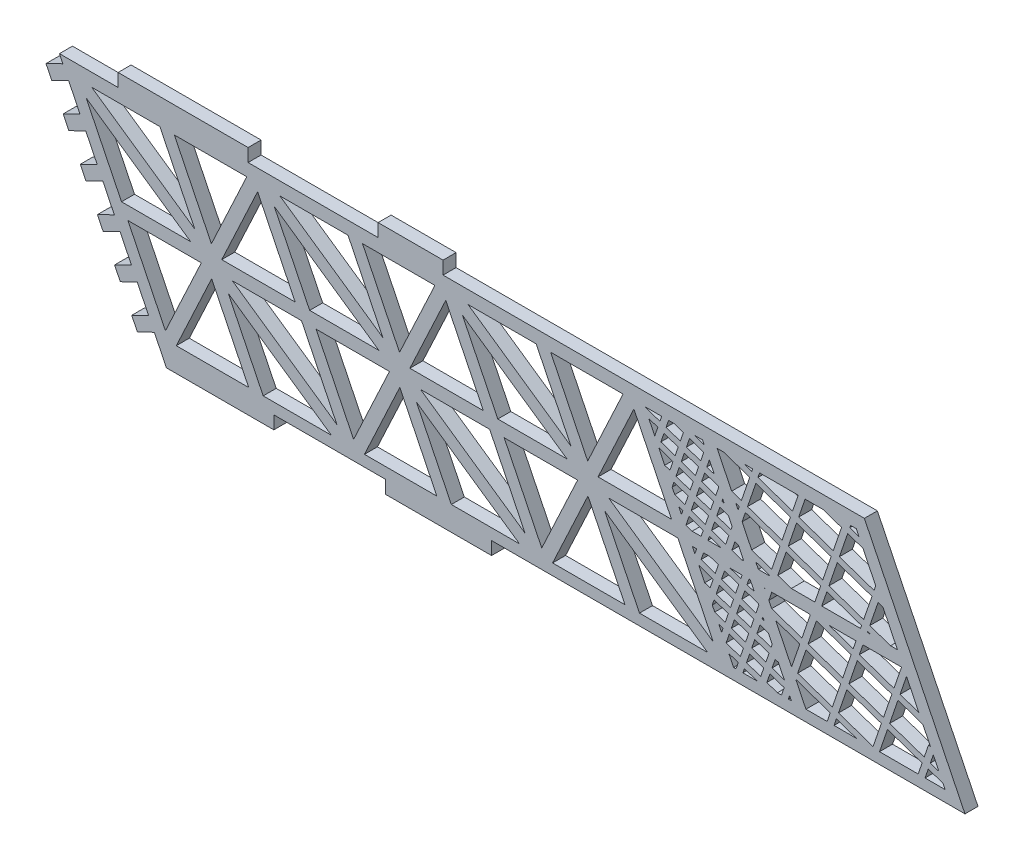
from build123d import *

# Parameters (mm, degrees)
BOSS_EXTRUDE1_DEPTH = 3


with BuildPart() as part:
    # Sketch1 → Boss-Extrude1 (new body)
    with BuildSketch(Plane.XY):
        Polygon((312.71484195, 243.542875257), (337.496593799, 243.542875257), (337.496593799, 246.542875257), (363.296593799, 246.542875257), (363.296593799, 243.542875257), (387.746593799, 243.542875257), (387.746593799, 246.542875257), (497, 246.542875257), (473.773721449, 293.999999999), (376.552067097, 293.999999999), (376.552067097, 296.999999999), (361.552067097, 296.999999999), (361.552067097, 293.999999999), (331.552067097, 293.999999999), (331.552067097, 296.999999999), (301.552067097, 296.999999999), (301.552067097, 293.999999999), (288.020315248, 293.999999999), (288.818498042, 292.369111937), (284.919287066, 290.460775502), (286.238063809, 287.766183157), (290.137274784, 289.674519593), (292.774828269, 284.285334903), (288.875617294, 282.376998468), (290.194394036, 279.682406124), (294.093605012, 281.590742559), (296.731158497, 276.20155787), (292.831947521, 274.293221435), (294.150724264, 271.59862909), (298.04993524, 273.506965525), (300.687488725, 268.117780836), (296.788277749, 266.209444401), (298.107054491, 263.514852056), (302.006265467, 265.423188492), (304.643818952, 260.034003802), (300.744607977, 258.125667367), (302.063384719, 255.431075023), (305.962595695, 257.339411458), (308.60014918, 251.950226769), (304.700938204, 250.041890334), (306.019714947, 247.347297989), (309.918925922, 249.255634424), align=None)
        Polygon((449.599551457, 291), (458.513861008, 291), (457.196332621, 287.156659589), (449.219446202, 289.891201205), align=None, mode=Mode.SUBTRACT)
        Polygon((448.733021931, 288.472260957), (456.70990835, 285.737719341), (454.788655317, 280.133263687), (446.811768899, 282.867805303), align=None, mode=Mode.SUBTRACT)
        Polygon((444.626136234, 281.117723724), (444.088838778, 282.215557471), (444.906404379, 281.935289326), align=None, mode=Mode.SUBTRACT)
        Polygon((445.39282865, 283.354229574), (443.1563228, 284.12092199), (439.789591611, 291), (441.3593959, 291), (447.314081683, 288.958685228), align=None, mode=Mode.SUBTRACT)
        Polygon((448.013861008, 291), (445.984987456, 291), (447.800505954, 290.377625476), align=None, mode=Mode.SUBTRACT)
        Polygon((454.302231046, 278.714323438), (452.380978014, 273.109867784), (447.772041399, 274.689848784), (445.558652211, 279.212359205), (446.325344628, 281.448865055), align=None, mode=Mode.SUBTRACT)
        Polygon((478.192302104, 256.41276843), (470.215415685, 259.147310046), (472.136668718, 264.7517657), (480.113555136, 262.017224084), align=None, mode=Mode.SUBTRACT)
        Polygon((480.599979407, 263.436164333), (472.623092989, 266.170705949), (473.440131839, 268.554076555), (482.35444139, 268.554076555), align=None, mode=Mode.SUBTRACT)
        Polygon((483.506468711, 267.28904497), (486.358224564, 261.462191006), (482.018919656, 262.949740062), align=None, mode=Mode.SUBTRACT)
        Polygon((487.290740541, 259.556826487), (489.057905157, 255.94606502), (488.587583378, 256.107295155), (487.588128771, 253.191802543), (479.611242352, 255.926344159), (481.532495385, 261.530799813), align=None, mode=Mode.SUBTRACT)
        Polygon((487.1017045, 251.772862294), (486.188220494, 249.108153109), (477.273910943, 249.108153109), (479.124818081, 254.507403911), align=None, mode=Mode.SUBTRACT)
        Polygon((475.7846248, 249.389372528), (467.807738381, 252.123914144), (469.728991414, 257.728369798), (477.705877833, 254.993828182), align=None, mode=Mode.SUBTRACT)
        Polygon((474.544346021, 271.775161603), (475.189269582, 271.554076555), (474.468556267, 271.554076555), align=None, mode=Mode.SUBTRACT)
        Polygon((476.952023325, 278.798557505), (478.059303344, 278.418972899), (481.419093798, 271.554076555), (479.814861137, 271.554076555), (475.030770292, 273.194101851), align=None, mode=Mode.SUBTRACT)
        Polygon((473.611830044, 273.680526122), (465.603422233, 276.425873529), (467.524675265, 282.030329183), (475.533083076, 279.284981776), align=None, mode=Mode.SUBTRACT)
        Polygon((472.882865817, 271.554076555), (463.933330561, 271.554076555), (465.116997962, 275.00693328), (473.125405773, 272.261585874), align=None, mode=Mode.SUBTRACT)
        Polygon((471.20415274, 266.65713022), (465.670601754, 268.554076555), (471.85444139, 268.554076555), align=None, mode=Mode.SUBTRACT)
        Polygon((468.796475437, 259.633734317), (460.788067625, 262.379081724), (462.709320658, 267.983537378), (470.717728469, 265.238189971), align=None, mode=Mode.SUBTRACT)
        Polygon((466.388798133, 252.610338415), (458.380390322, 255.355685821), (460.301643355, 260.960141475), (468.310051166, 258.214794069), align=None, mode=Mode.SUBTRACT)
        Polygon((476.399091954, 281.811202044), (473.443584745, 287.850046105), (469.932352569, 289.053725085), (468.011099536, 283.449269431), (476.019507347, 280.703922025), align=None, mode=Mode.SUBTRACT)
        Polygon((455.721171295, 278.227899167), (463.698057713, 275.493357551), (462.347640112, 271.554076555), (456.919351047, 271.554076555), (453.799918262, 272.623443513), align=None, mode=Mode.SUBTRACT)
        Polygon((458.128848598, 285.25129507), (466.105735017, 282.516753453), (464.184481984, 276.9122978), (456.207595566, 279.646839416), align=None, mode=Mode.SUBTRACT)
        Polygon((460.099551457, 291.000000001), (464.254905991, 291.000000001), (468.51341232, 289.540149356), (466.592159288, 283.935693702), (458.615272869, 286.670235318), align=None, mode=Mode.SUBTRACT)
        Polygon((451.847640112, 271.554076555), (449.306738658, 271.554076555), (448.704557377, 272.784484265), (451.894553743, 271.690927536), align=None, mode=Mode.SUBTRACT)
        Polygon((450.800997014, 268.50093117), (450.774986809, 268.554076555), (450.819215684, 268.554076555), align=None, mode=Mode.SUBTRACT)
        Polygon((470.599551457, 291.000000001), (471.90194675, 291.000000001), (472.511068767, 289.755410624), (470.41877684, 290.472665333), align=None, mode=Mode.SUBTRACT)
        Polygon((469.013861008, 291.000000001), (468.880497546, 291.000000001), (468.999836591, 290.959089604), align=None, mode=Mode.SUBTRACT)
        Polygon((461.045010199, 268.554076555), (461.29038041, 268.469961649), (459.369127377, 262.865505995), (452.387759998, 265.258775578), (451.733512991, 266.595566651), (452.404906134, 268.554076555), align=None, mode=Mode.SUBTRACT)
        Polygon((456.975857793, 255.884138616), (453.320275975, 263.353411059), (458.882703106, 261.446565746), align=None, mode=Mode.SUBTRACT)
        Polygon((471.97937379, 249.108153109), (466.773910943, 249.108153109), (467.32131411, 250.704973895), align=None, mode=Mode.SUBTRACT)
        Polygon((460.292133857, 249.108153109), (457.935994574, 253.922337853), (465.902373862, 251.191398167), (465.188220494, 249.108153109), align=None, mode=Mode.SUBTRACT)
        Polygon((490.973943163, 252.0311178), (489.007069019, 252.705378272), (489.681329491, 254.672252416), align=None, mode=Mode.SUBTRACT)
        Polygon((491.90645914, 250.125753281), (492.404488997, 249.108153109), (487.773910943, 249.108153109), (488.520644748, 251.286438023), align=None, mode=Mode.SUBTRACT)
        Polygon((429.608825727, 283.255040205), (428.891411346, 281.162282502), (427.705195964, 281.568926794), (426.329852642, 284.379098878), align=None, mode=Mode.SUBTRACT)
        Polygon((427.533691294, 287.890796829), (430.812664379, 286.766738156), (430.095249998, 284.673980454), (426.816276913, 285.798039126), align=None, mode=Mode.SUBTRACT)
        Polygon((428.599551457, 291), (429.911640855, 291), (432.01650303, 290.278436108), (431.29908865, 288.185678405), (428.020115564, 289.309737078), align=None, mode=Mode.SUBTRACT)
        Polygon((427.013861008, 291), (423.089477365, 291), (426.601175316, 289.796161349), align=None, mode=Mode.SUBTRACT)
        Polygon((425.397336664, 286.284463397), (424.021993342, 289.094635481), (426.114751045, 288.3772211), align=None, mode=Mode.SUBTRACT)
        Polygon((429.266601563, 271.554076555), (420.596417461, 289.269441828), (412.317320254, 271.554076555), align=None, mode=Mode.SUBTRACT)
        Polygon((429.823927323, 279.256917983), (433.102900409, 278.13285931), (432.385486028, 276.040101608), (430.013055263, 276.853390191), (429.417283032, 278.070702601), align=None, mode=Mode.SUBTRACT)
        Polygon((431.027765975, 282.768615934), (434.30673906, 281.644557262), (433.589324679, 279.551799559), (430.310351594, 280.675858232), align=None, mode=Mode.SUBTRACT)
        Polygon((432.231604627, 286.280313885), (435.510577712, 285.156255213), (434.793163331, 283.06349751), (431.514190246, 284.187556183), align=None, mode=Mode.SUBTRACT)
        Polygon((433.435443279, 289.792011837), (436.714416364, 288.667953164), (435.997001983, 286.575195461), (432.718028898, 287.699254134), align=None, mode=Mode.SUBTRACT)
        Polygon((433.318002005, 274.134737088), (436.59697509, 273.010678416), (436.097640112, 271.554076555), (434.023840956, 271.554076555), (432.600587624, 272.041979386), align=None, mode=Mode.SUBTRACT)
        Polygon((434.521840657, 277.646435039), (437.800813742, 276.522376367), (437.083399361, 274.429618664), (433.804426276, 275.553677337), align=None, mode=Mode.SUBTRACT)
        Polygon((435.725679309, 281.158132991), (439.004652394, 280.034074318), (438.287238013, 277.941316615), (435.008264928, 279.065375288), align=None, mode=Mode.SUBTRACT)
        Polygon((436.929517961, 284.669830942), (440.075469691, 283.591373073), (440.162890242, 283.412750914), (439.491076665, 281.453014566), (436.21210358, 282.577073239), align=None, mode=Mode.SUBTRACT)
        Polygon((438.00797583, 287.815782672), (439.142953713, 285.496737592), (437.415942231, 286.08877119), align=None, mode=Mode.SUBTRACT)
        Polygon((431.572197444, 273.667670843), (430.945571241, 274.948025672), (431.899061757, 274.621161359), align=None, mode=Mode.SUBTRACT)
        Polygon((438.902888385, 251.864720607), (430.734849714, 268.554076555), (414.767208942, 268.554076555), align=None, mode=Mode.SUBTRACT)
        Polygon((435.608238035, 265.500858242), (438.88721112, 264.37679957), (438.169796739, 262.284041867), (436.936633161, 262.706780382), (435.592143811, 265.453910046), align=None, mode=Mode.SUBTRACT)
        Polygon((436.654906134, 268.554076555), (438.149500108, 268.554076555), (440.091049772, 267.888497521), (439.373635391, 265.795739818), (436.094662306, 266.919798491), align=None, mode=Mode.SUBTRACT)
        Polygon((438.015915339, 272.524254145), (440.846004446, 271.554076555), (437.683330561, 271.554076555), align=None, mode=Mode.SUBTRACT)
        Polygon((439.219753991, 276.035952096), (442.498727076, 274.911893423), (441.781312695, 272.81913572), (438.50233961, 273.943194393), align=None, mode=Mode.SUBTRACT)
        Polygon((440.423592642, 279.547650047), (442.38332899, 278.87583647), (443.250320632, 277.104354637), (442.985151346, 276.330833672), (439.706178261, 277.454892344), align=None, mode=Mode.SUBTRACT)
        Polygon((441.09540622, 281.507386395), (441.450813013, 280.781200989), (440.910016913, 280.966590295), align=None, mode=Mode.SUBTRACT)
        Polygon((434.675722058, 267.406222762), (434.628773862, 267.422316985), (434.074872564, 268.554076555), (435.069215684, 268.554076555), align=None, mode=Mode.SUBTRACT)
        Polygon((439.102312717, 260.378677347), (442.381285802, 259.254618675), (441.663871421, 257.161860972), (439.244492461, 257.991243779), (438.679574201, 259.145513769), align=None, mode=Mode.SUBTRACT)
        Polygon((440.306151369, 263.890375299), (443.585124454, 262.766316626), (442.867710073, 260.673558923), (439.588736988, 261.797617596), align=None, mode=Mode.SUBTRACT)
        Polygon((441.50999002, 267.40207325), (444.788963106, 266.278014577), (444.071548725, 264.185256874), (440.79257564, 265.309315547), align=None, mode=Mode.SUBTRACT)
        Polygon((443.917667324, 274.425469152), (444.69118829, 274.160299867), (445.966715809, 271.554076555), (445.471596001, 271.554076555), (443.200252943, 272.332711449), align=None, mode=Mode.SUBTRACT)
        Polygon((442.596387399, 255.256496453), (445.875360484, 254.13243778), (445.157946103, 252.039680077), (441.878973018, 253.16373875), align=None, mode=Mode.SUBTRACT)
        Polygon((443.80022605, 258.768194404), (447.079199135, 257.644135731), (446.361784755, 255.551378028), (443.08281167, 256.675436701), align=None, mode=Mode.SUBTRACT)
        Polygon((445.004064702, 262.279892355), (448.283037787, 261.155833682), (447.565623406, 259.06307598), (444.286650321, 260.187134652), align=None, mode=Mode.SUBTRACT)
        Polygon((446.207903354, 265.791590306), (449.306906888, 264.729226661), (449.425181412, 264.487562083), (448.769462058, 262.574773931), (445.490488973, 263.698832603), align=None, mode=Mode.SUBTRACT)
        Polygon((447.154906134, 268.554076555), (447.43496396, 268.554076555), (448.374390911, 266.63459118), (446.694327625, 267.210530555), align=None, mode=Mode.SUBTRACT)
        Polygon((445.275387376, 267.696954826), (442.775091663, 268.554076555), (445.569215684, 268.554076555), align=None, mode=Mode.SUBTRACT)
        Polygon((440.834488614, 254.742482012), (440.177008438, 256.08587926), (441.17744715, 255.742920723), align=None, mode=Mode.SUBTRACT)
        Polygon((445.738685237, 249.108153109), (449.083863699, 249.108153109), (446.09046208, 250.134315558), align=None, mode=Mode.SUBTRACT)
        Polygon((447.294300732, 253.646013509), (450.573273817, 252.521954836), (449.855859436, 250.429197133), (446.576886351, 251.553255806), align=None, mode=Mode.SUBTRACT)
        Polygon((448.498139384, 257.15771146), (451.777112469, 256.033652787), (451.059698088, 253.940895085), (447.780725003, 255.064953757), align=None, mode=Mode.SUBTRACT)
        Polygon((449.701978036, 260.669409411), (451.614766188, 260.013690058), (452.512611802, 258.179165806), (452.26353674, 257.452593036), (448.984563655, 258.576651709), align=None, mode=Mode.SUBTRACT)
        Polygon((450.357697389, 262.582197564), (450.68225021, 261.919054577), (450.188402307, 262.08834966), align=None, mode=Mode.SUBTRACT)
        Polygon((443.592019611, 249.108153109), (442.484867738, 251.370342657), (444.671521832, 250.620739829), (444.152994788, 249.108153109), align=None, mode=Mode.SUBTRACT)
        Polygon((451.992214066, 252.035530565), (455.271187151, 250.911471893), (454.652994788, 249.108153109), (453.709455254, 249.108153109), (451.274799685, 249.942772863), align=None, mode=Mode.SUBTRACT)
        Polygon((453.196052717, 255.547228516), (453.922625487, 255.298153455), (455.297968809, 252.487981371), (452.478638337, 253.454470814), align=None, mode=Mode.SUBTRACT)
        Polygon((456.952111008, 249.108153109), (456.238685237, 249.108153109), (456.532558169, 249.965405009), align=None, mode=Mode.SUBTRACT)
        Polygon((434.53723241, 291), (436.449568761, 291), (436.835094414, 290.212274195), align=None, mode=Mode.SUBTRACT)
        Polygon((295.465948631, 290.999999999), (311.198711918, 290.999999999), (319.246602071, 274.556137672), align=None, mode=Mode.SUBTRACT)
        Polygon((294.177694625, 288.243432502), (302.345733296, 271.554076554), (318.313374068, 271.554076554), align=None, mode=Mode.SUBTRACT)
        Polygon((343.894255637, 268.554076554), (352.062294307, 251.864720606), (327.926614865, 268.554076554), align=None, mode=Mode.SUBTRACT)
        Polygon((335.041277014, 249.108153108), (326.993386862, 265.552015436), (350.774040302, 249.108153108), align=None, mode=Mode.SUBTRACT)
        Polygon((345.766030335, 271.554076554), (337.597991664, 288.243432502), (361.733671107, 271.554076554), align=None, mode=Mode.SUBTRACT)
        Polygon((354.619008957, 291), (362.66689911, 274.556137672), (338.88624567, 291), align=None, mode=Mode.SUBTRACT)
        Polygon((387.314552676, 268.554076554), (395.482591346, 251.864720606), (371.346911903, 268.554076554), align=None, mode=Mode.SUBTRACT)
        Polygon((378.461574053, 249.108153109), (370.413683901, 265.552015436), (394.194337341, 249.108153109), align=None, mode=Mode.SUBTRACT)
        Polygon((389.186327374, 271.554076554), (381.018288703, 288.243432502), (405.153968146, 271.554076554), align=None, mode=Mode.SUBTRACT)
        Polygon((398.039305996, 291), (406.087196149, 274.556137673), (382.306542709, 291), align=None, mode=Mode.SUBTRACT)
        Polygon((401.827444418, 249.108153109), (409.991812659, 266.578024762), (418.541848243, 249.108153109), align=None, mode=Mode.SUBTRACT)
        Polygon((312.484165549, 250.838711281), (303.813981447, 268.554076554), (320.763262756, 268.554076554), align=None, mode=Mode.SUBTRACT)
        Polygon((333.755823383, 289.269441827), (342.426007486, 271.554076554), (325.476726177, 271.554076554), align=None, mode=Mode.SUBTRACT)
        Polygon((314.98685034, 249.108153108), (331.701254165, 249.108153108), (323.151218581, 266.578024761), align=None, mode=Mode.SUBTRACT)
        Polygon((331.253138592, 291), (314.538734768, 291), (323.088770352, 273.530128347), align=None, mode=Mode.SUBTRACT)
        Polygon((355.904462588, 250.838711281), (347.234278486, 268.554076554), (364.183559795, 268.554076554), align=None, mode=Mode.SUBTRACT)
        Polygon((358.407147379, 249.108153108), (375.121551204, 249.108153108), (366.57151562, 266.578024761), align=None, mode=Mode.SUBTRACT)
        Polygon((377.176120422, 289.269441828), (385.846304525, 271.554076554), (368.897023215, 271.554076554), align=None, mode=Mode.SUBTRACT)
        Polygon((374.673435631, 291), (357.959031806, 291), (366.50906739, 273.530128347), align=None, mode=Mode.SUBTRACT)
        Polygon((399.324759627, 250.838711281), (390.654575525, 268.554076554), (407.603856834, 268.554076554), align=None, mode=Mode.SUBTRACT)
        Polygon((418.09373267, 291), (401.379328845, 291), (409.929364429, 273.530128347), align=None, mode=Mode.SUBTRACT)
        Polygon((421.881871092, 249.108153109), (413.833980939, 265.552015436), (437.61463438, 249.108153109), align=None, mode=Mode.SUBTRACT)
    extrude(amount=BOSS_EXTRUDE1_DEPTH)


solid = part.part
